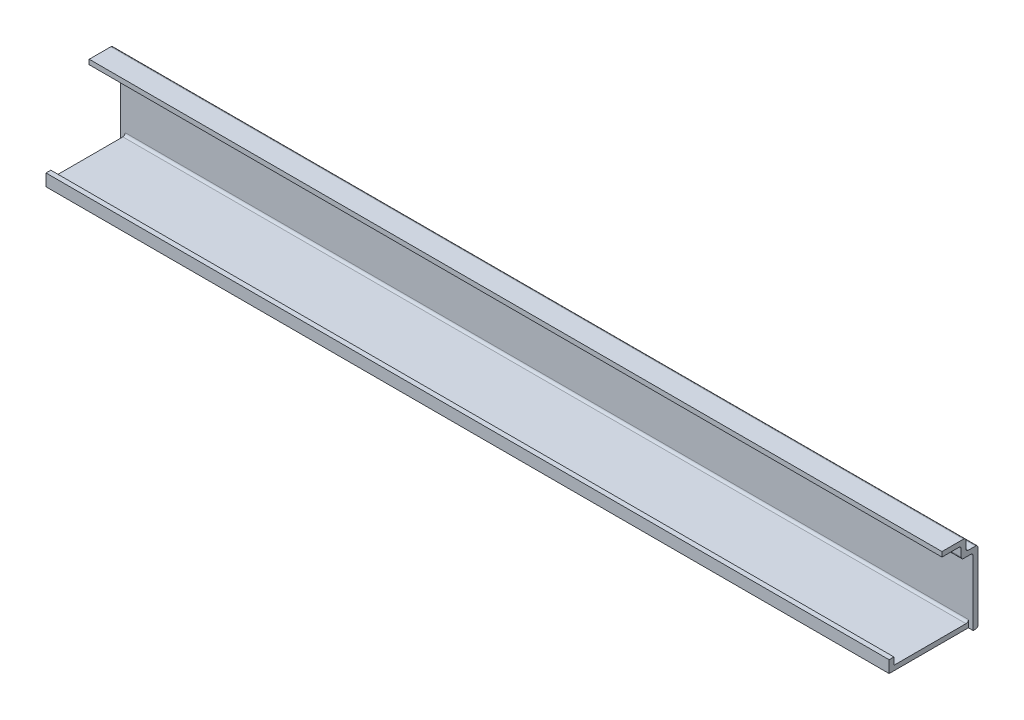
from build123d import *

# Parameters (mm, degrees)
BOSS_EXTRUDE5_DEPTH = 355
SKETCH7_W           = 2
SKETCH7_H           = 27.946586717
CUT_EXTRUDE1_DEPTH  = 33
SKETCH9_W           = 2
SKETCH9_H           = 28
CUT_EXTRUDE2_DEPTH  = 33
FILLET4_R           = 1
FILLET5_R           = 1
FILLET6_R           = 1
FILLET7_R           = 1


with BuildPart() as part:
    # Sketch6 → Boss-Extrude5 (new body)
    with BuildSketch(Plane(origin=(0, 0, 0), x_dir=(0, 0, -1), z_dir=(1, 0, 0))):
        Polygon((0, 3), (0, 0), (31, 0), (31, 26), (26, 26), (26, 31), (18, 31), (18, 33), (28, 33), (28, 28), (33, 28), (33, -2), (-2, -2), (-2, 3), align=None)
    extrude(amount=-BOSS_EXTRUDE5_DEPTH)

    # Sketch7 → Cut-Extrude1 (cut)
    with BuildSketch(Plane.XY.offset(2)):
        with Locations((-1, 11.973293359)):
            Rectangle(SKETCH7_W, SKETCH7_H)
    extrude(amount=-CUT_EXTRUDE1_DEPTH, mode=Mode.SUBTRACT)

    # Sketch9 → Cut-Extrude2 (cut)
    with BuildSketch(Plane.XY.offset(2)):
        with Locations((-354, 12)):
            Rectangle(SKETCH9_W, SKETCH9_H)
    extrude(amount=-CUT_EXTRUDE2_DEPTH, mode=Mode.SUBTRACT)

    # Fillet4
    fillet4_edges = [part.edges().sort_by_distance(p)[0] for p in [
        (-177.5, 26, -31),
        (-177.5, 31, -26),
        (-177.5, 33, -28),
        (-177.5, 28, -28),
        (-177.5, 28, -33),
    ]]
    fillet(fillet4_edges, radius=FILLET4_R)

    # Fillet5
    fillet5_edges = [part.edges().sort_by_distance(p)[0] for p in [
        (-177.5, -2, -33),
    ]]
    fillet(fillet5_edges, radius=FILLET5_R)

    # Fillet6
    fillet6_edges = [part.edges().sort_by_distance(p)[0] for p in [
        (-177.5, 0, -31),
    ]]
    fillet(fillet6_edges, radius=FILLET6_R)

    # Fillet7
    fillet7_edges = [part.edges().sort_by_distance(p)[0] for p in [
        (-177.5, 26, -26),
    ]]
    fillet(fillet7_edges, radius=FILLET7_R)


solid = part.part
